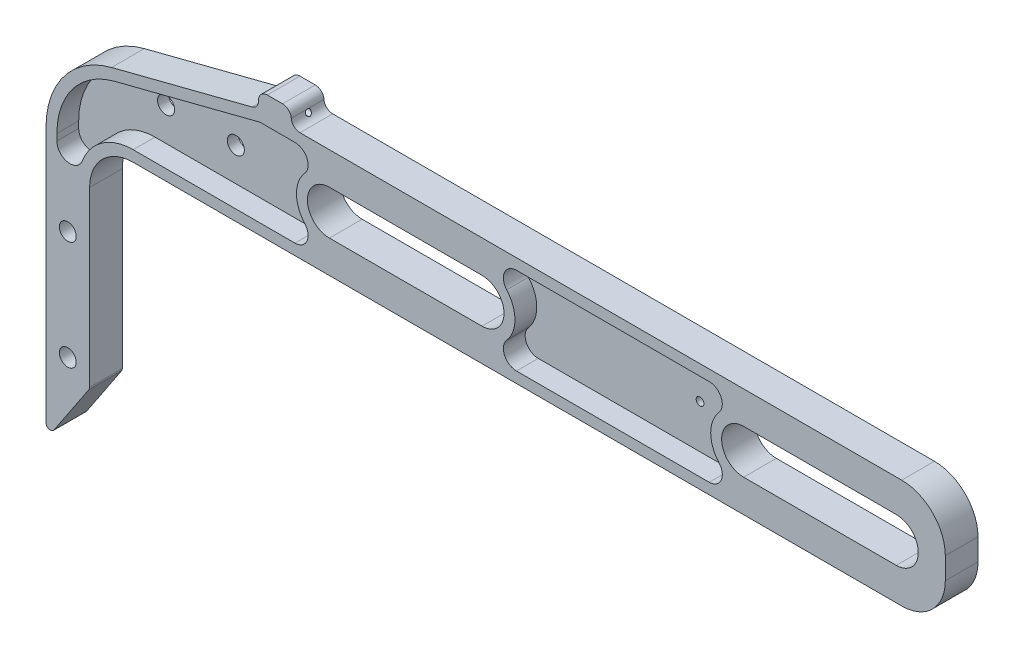
from build123d import *

# Parameters (mm, degrees)
BOSS_EXTRUDE1_DEPTH          = 4.7625
F_4_40_TAPPED_HOLE1_D        = 2.2606
FILLET1_R                    = 12.7
FILLET2_R                    = 25.4
FILLET3_R                    = 12.7
CUT_EXTRUDE1_DEPTH           = 6.35
F_10_0_1935_DIAMETER_HOLE1_D = 4.9149
FILLET4_R                    = 2.54
FILLET5_R                    = 2.54
CUT_EXTRUDE3_DEPTH           = 269.723942484
CUT_EXTRUDE3_DEPTH_BACK      = 269.723942484
SKETCH33_R                   = 0.79375
FILLET6_R                    = 1.27
CUT_EXTRUDE8_DEPTH           = 244.984857834
CUT_EXTRUDE8_DEPTH_BACK      = 244.984857834
SKETCH40_R                   = 2.4892


with BuildPart() as part:
    # Sketch1 → Boss-Extrude1 (new, symmetric)
    with BuildSketch(Plane.XY):
        Polygon((-152.4, 79.375), (-152.4, 142.875), (96.8375, 142.875), (96.8375, 174.625), (-93.6625, 174.625), (-93.6625, 179.3875), (-103.1875, 179.3875), (-103.1875, 174.625), (-165.1, 158.75), (-165.1, 60.325), align=None)
        with BuildLine():
            Line((82.55, 152.3365), (38.1, 152.3365))
            ThreePointArc((38.1, 152.3365), (31.6865, 158.75), (38.1, 165.1635))
            Line((38.1, 165.1635), (82.55, 165.1635))
            ThreePointArc((82.55, 165.1635), (88.9635, 158.75), (82.55, 152.3365))
        make_face(mode=Mode.SUBTRACT)
        with BuildLine():
            Line((-82.55, 165.1635), (-38.1, 165.1635))
            ThreePointArc((-38.1, 165.1635), (-31.6865, 158.75), (-38.1, 152.3365))
            Line((-38.1, 152.3365), (-82.55, 152.3365))
            ThreePointArc((-82.55, 152.3365), (-88.9635, 158.75), (-82.55, 165.1635))
        make_face(mode=Mode.SUBTRACT)
    extrude(amount=BOSS_EXTRUDE1_DEPTH, both=True)

    # #4-40 Tapped Hole1 (through all)
    with Locations(Plane.XY.offset(4.7625)):
        with Locations((19.05, 158.75)):
            Hole(F_4_40_TAPPED_HOLE1_D / 2)

    # Fillet1
    fillet1_edges = [part.edges().sort_by_distance(p)[0] for p in [
        (96.8375, 174.625, 0),
        (96.8375, 142.875, 0),
    ]]
    fillet(fillet1_edges, radius=FILLET1_R)

    # Fillet2
    fillet2_edges = [part.edges().sort_by_distance(p)[0] for p in [
        (-165.1, 158.75, 0),
    ]]
    fillet(fillet2_edges, radius=FILLET2_R)

    # Fillet3
    fillet3_edges = [part.edges().sort_by_distance(p)[0] for p in [
        (-152.4, 142.875, 0),
    ]]
    fillet(fillet3_edges, radius=FILLET3_R)

    # Sketch29 → Cut-Extrude1 (cut)
    with BuildSketch(Plane.XY.offset(4.7625)):
        with BuildLine():
            Line((-102.786927942, 171.45), (-145.22014216, 160.569688662))
            ThreePointArc((-145.22014216, 160.569688662), (-157.258983235, 152.665844612), (-161.925, 139.041134239))
            Line((-161.925, 139.041134239), (-161.925, 137.13107648))
            ThreePointArc((-161.925, 137.13107648), (-158.799296201, 133.383031829), (-154.550806452, 135.784739097))
            ThreePointArc((-154.550806452, 135.784739097), (-148.726655439, 143.233909471), (-139.7, 146.05))
            Line((-139.7, 146.05), (-92.574355453, 146.05))
            ThreePointArc((-92.574355453, 146.05), (-89.099615496, 148.297219712), (-89.723827836, 152.387962085))
            ThreePointArc((-89.723827836, 152.387962085), (-92.1385, 158.75), (-89.723827836, 165.112037915))
            ThreePointArc((-89.723827836, 165.112037915), (-89.099615496, 169.202780288), (-92.574355453, 171.45))
            Line((-92.574355453, 171.45), (-102.786927942, 171.45))
        make_face()
        with BuildLine():
            Line((28.075644547, 171.45), (-28.075644547, 171.45))
            ThreePointArc((-28.075644547, 171.45), (-31.550384504, 169.202780288), (-30.926172164, 165.112037915))
            ThreePointArc((-30.926172164, 165.112037915), (-28.5115, 158.75), (-30.926172164, 152.387962085))
            ThreePointArc((-30.926172164, 152.387962085), (-31.550384504, 148.297219712), (-28.075644547, 146.05))
            Line((-28.075644547, 146.05), (28.075644547, 146.05))
            ThreePointArc((28.075644547, 146.05), (31.550384504, 148.297219712), (30.926172164, 152.387962085))
            ThreePointArc((30.926172164, 152.387962085), (28.5115, 158.75), (30.926172164, 165.112037915))
            ThreePointArc((30.926172164, 165.112037915), (31.550384504, 169.202780288), (28.075644547, 171.45))
        make_face()
    extrude(amount=-CUT_EXTRUDE1_DEPTH, mode=Mode.SUBTRACT)

    # #10 (0.1935) Diameter Hole1 (through all)
    with Locations(Plane.XY.offset(4.7625)):
        with Locations((-158.75, 84.1375), (-158.75, 115.8875)):
            Hole(F_10_0_1935_DIAMETER_HOLE1_D / 2)

    # Fillet4
    fillet4_edges = [part.edges().sort_by_distance(p)[0] for p in [
        (-103.1875, 174.625, 0),
        (-93.6625, 174.625, 0),
    ]]
    fillet(fillet4_edges, radius=FILLET4_R)

    # Fillet5
    fillet5_edges = [part.edges().sort_by_distance(p)[0] for p in [
        (-93.6625, 179.3875, 0),
        (-103.1875, 179.3875, 0),
    ]]
    fillet(fillet5_edges, radius=FILLET5_R)

    # Sketch33 → Cut-Extrude3 (cut, two sides: drawn at the far end of the back side and taken through both)
    with BuildSketch(Plane.ZY.offset(103.1875).offset(-CUT_EXTRUDE3_DEPTH_BACK)):
        with Locations(Location((0, 176.2125, 0), (0, 0, 28.881959817))):
            Circle(SKETCH33_R)
    extrude(amount=CUT_EXTRUDE3_DEPTH + CUT_EXTRUDE3_DEPTH_BACK, mode=Mode.SUBTRACT)

    # Fillet6
    fillet6_edges = [part.edges().sort_by_distance(p)[0] for p in [
        (-165.1, 60.325, 0),
        (-152.4, 79.375, 0),
    ]]
    fillet(fillet6_edges, radius=FILLET6_R)

    # Sketch40 → Cut-Extrude8 (cut, two sides: drawn at the far end of the back side and taken through both)
    with BuildSketch(Plane.XY.offset(4.7625).offset(-CUT_EXTRUDE8_DEPTH_BACK)):
        with Locations((-136.480089751, 155.784044032)):
            Circle(SKETCH40_R)
        with Locations((-116.160089751, 155.784044032)):
            Circle(SKETCH40_R)
    extrude(amount=CUT_EXTRUDE8_DEPTH + CUT_EXTRUDE8_DEPTH_BACK, mode=Mode.SUBTRACT)


solid = part.part
